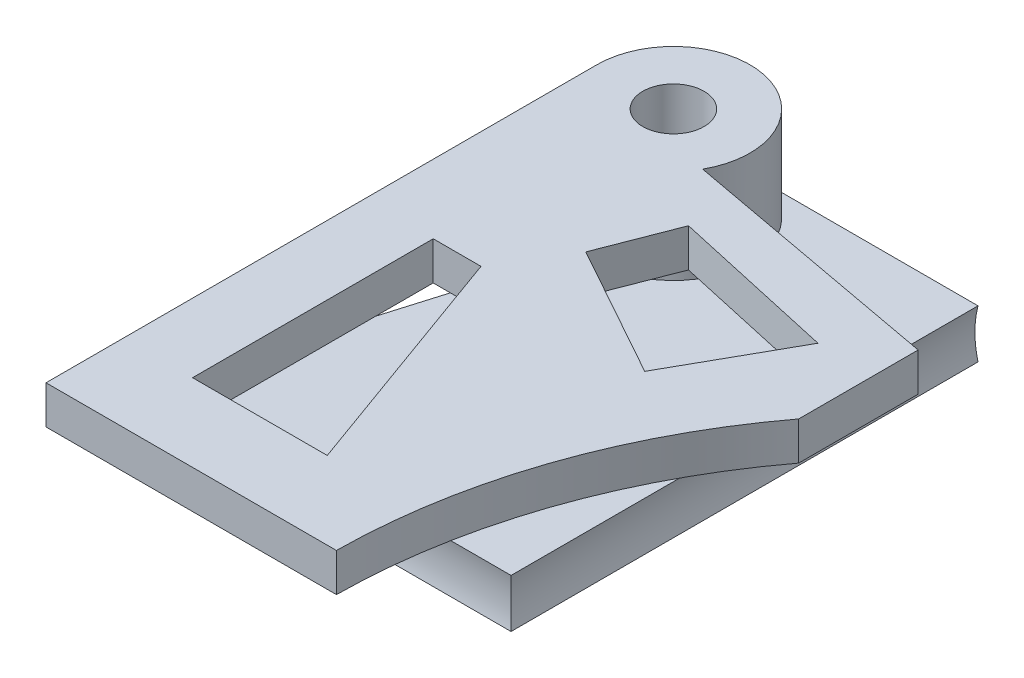
from build123d import *

# Parameters (mm, degrees)
BOSS_EXTRUDE1_DEPTH     = 6.35
SKETCH1_3_R             = 4
BOSS_EXTRUDE2_DEPTH     = 18.7
CUT_EXTRUDE1_DEPTH      = 55.130565784
CUT_EXTRUDE1_DEPTH_BACK = 55.130565784
SKETCH3_R               = 12.5
CUT_EXTRUDE3_DEPTH      = 55.130565784
CUT_EXTRUDE3_DEPTH_BACK = 55.130565784
SKETCH4_R               = 12.5
BOSS_EXTRUDE3_START     = -5
BOSS_EXTRUDE3_DEPTH     = 5


with BuildPart() as part:
    # Sketch1 → Boss-Extrude1 (new body)
    with BuildSketch(Plane(origin=(0, 0, 0), x_dir=(1, 0, 0), z_dir=(0, 1, 0))):
        with BuildLine():
            Line((30.820134884, -20.651845529), (30.820134884, 40.348154471))
            Line((30.820134884, 40.348154471), (1.797901548, 40.348154471))
            ThreePointArc((1.797901548, 40.348154471), (8.347755505, 37.163141176), (11.000000332, 30.380037615))
            ThreePointArc((11.000000332, 30.380037615), (7.256441333, 22.578951408), (-1.171388868, 20.618630496))
            Line((-1.171388868, 20.618630496), (-13.427648664, -20.651845529))
            Line((-13.427648664, -20.651845529), (30.820134884, -20.651845529))
        make_face()
    extrude(amount=BOSS_EXTRUDE1_DEPTH)

    # Sketch1<3> → Boss-Extrude2 (add)
    with BuildSketch(Plane(origin=(0, 0, 0), x_dir=(1, 0, 0), z_dir=(0, 1, 0))):
        with BuildLine():
            ThreePointArc((11.000000332, 30.380037615), (8.347755505, 37.163141176), (1.797901548, 40.348154471))
            ThreePointArc((1.797901548, 40.348154471), (-8.888636903, 31.868276044), (-1.171388868, 20.618630496))
            ThreePointArc((-1.171388868, 20.618630496), (7.256441333, 22.578951408), (11.000000332, 30.380037615))
        make_face()
        with Locations((1.000000332, 30.380037615)):
            Circle(SKETCH1_3_R, mode=Mode.SUBTRACT)
    extrude(amount=BOSS_EXTRUDE2_DEPTH)

    # Sketch3 → Cut-Extrude1 (cut, two sides: drawn at the far end of the back side and taken through both)
    with BuildSketch(Plane.XY.offset(-CUT_EXTRUDE1_DEPTH_BACK)):
        with Locations((42.910187614, 3.175)):
            Circle(SKETCH3_R)
    extrude(amount=CUT_EXTRUDE1_DEPTH + CUT_EXTRUDE1_DEPTH_BACK, mode=Mode.SUBTRACT)

    # Sketch4 → Cut-Extrude3 (cut, two sides: drawn at the far end of the back side and taken through both)
    with BuildSketch(Plane(origin=(0, 0, 0), x_dir=(0, 0, -1), z_dir=(1, 0, 0)).offset(-CUT_EXTRUDE3_DEPTH_BACK)):
        with Locations((-32.741898259, 3.175)):
            Circle(SKETCH4_R)
    extrude(amount=CUT_EXTRUDE3_DEPTH + CUT_EXTRUDE3_DEPTH_BACK, mode=Mode.SUBTRACT)

    # Sketch5 → Boss-Extrude3 (add)
    with BuildSketch(Plane(origin=(0, 18.7, 0), x_dir=(1, 0, 0), z_dir=(0, 1, 0)).offset(BOSS_EXTRUDE3_START)):
        with BuildLine():
            ThreePointArc((9.716620703, 25.478963312), (-1.533159384, 20.706201672), (-8.999999668, 30.380037615))
            Line((-8.999999668, 30.380037615), (-8.999999668, -41.582926526))
            Line((-8.999999668, -41.582926526), (28.938924754, -41.582926526))
            ThreePointArc((28.938924754, -41.582926526), (32.982787431, -17.815786501), (44.256083353, 3.494834546))
            Line((44.256083353, 3.494834546), (44.256083353, 19.094758402))
            Line((44.256083353, 19.094758402), (9.716620703, 25.478963312))
        make_face()
        Polygon((17.594978634, -31.436293162), (0, -31.436293162), (0, 0), (6.242345966, 0), align=None, mode=Mode.SUBTRACT)
        Polygon((28.816009284, -1.183711765), (11.455147871, 8.481691767), (15.20184924, 18.147095298), (36.949007186, 13.314393532), align=None, mode=Mode.SUBTRACT)
    extrude(amount=BOSS_EXTRUDE3_DEPTH)


solid = part.part
